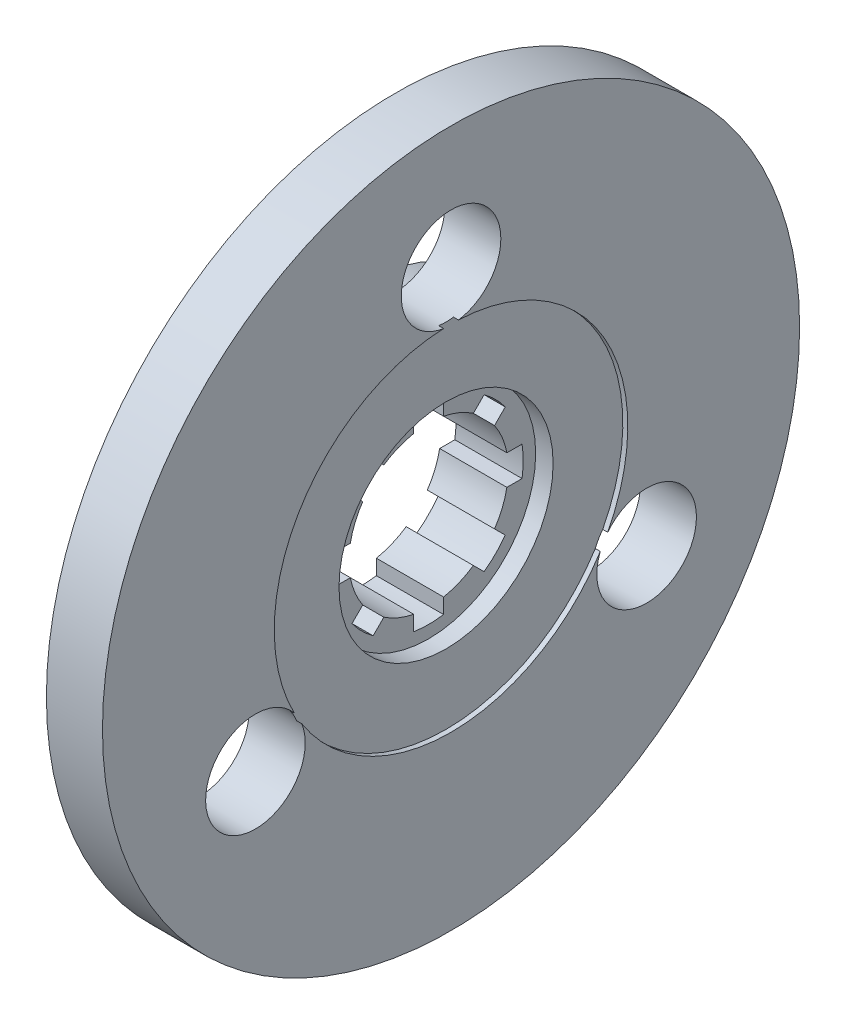
from build123d import *

# Parameters (mm, degrees)
SKETCH_2_R               = 10
CUT_EXTRUDE_1_DEPTH      = 102.323474928
PATTERN_CIRCULAR_1_COUNT = 3
CUT_EXTRUDE_2_DEPTH      = 102.323474928
PATTERN_CIRCULAR_2_COUNT = 8


with BuildPart() as part:
    # 草图1 → 旋转1 (revolve)
    with BuildSketch(Plane.XY):
        Polygon((-3.597374179, 35.5), (-3.597374179, 70), (-14.857768053, 70), (-14.857768053, 33.5), (-21.597374179, 33.5), (-21.597374179, 16), (-8.097374179, 16), (-8.097374179, 21.5), (-4.597374179, 21.5), (-4.597374179, 35.5), align=None)
    revolve(axis=Axis((-66.01750547, 0, 0), (1, 0, 0)))

    # 草图2 → 切除-拉伸1 (cut, through all)
    with BuildSketch(Plane(origin=(0, 0, 0), x_dir=(0, 0, -1), z_dir=(1, 0, 0))):
        with Locations((0, 45.357)):
            Circle(SKETCH_2_R)
    cut_extrude_1 = extrude(amount=-CUT_EXTRUDE_1_DEPTH, mode=Mode.SUBTRACT)

    # 阵列(圆周)1: 切除-拉伸1 ×3 about axis
    pattern_circular_1_axis = Axis((-66.01750547, 0, 0), (-1, 0, 0))
    for i in range(1, PATTERN_CIRCULAR_1_COUNT):
        add(cut_extrude_1.rotate(pattern_circular_1_axis, i * 360 / PATTERN_CIRCULAR_1_COUNT), mode=Mode.SUBTRACT)

    # 草图3 → 切除-拉伸2 (cut, through all)
    with BuildSketch(Plane(origin=(0, 0, 0), x_dir=(0, 0, -1), z_dir=(1, 0, 0))):
        with BuildLine():
            Line((3, 15.716233646), (3, 18.761663039))
            ThreePointArc((3, 18.761663039), (0, 19), (-3, 18.761663039))
            Line((-3, 18.761663039), (-3, 15.716233646))
            ThreePointArc((-3, 15.716233646), (0, 16), (3, 15.716233646))
        make_face()
    cut_extrude_2 = extrude(amount=-CUT_EXTRUDE_2_DEPTH, mode=Mode.SUBTRACT)

    # 阵列(圆周)2: 切除-拉伸2 ×8 about axis
    pattern_circular_2_axis = Axis((-66.01750547, 0, 0), (-1, 0, 0))
    for i in range(1, PATTERN_CIRCULAR_2_COUNT):
        add(cut_extrude_2.rotate(pattern_circular_2_axis, i * 360 / PATTERN_CIRCULAR_2_COUNT), mode=Mode.SUBTRACT)


solid = part.part
